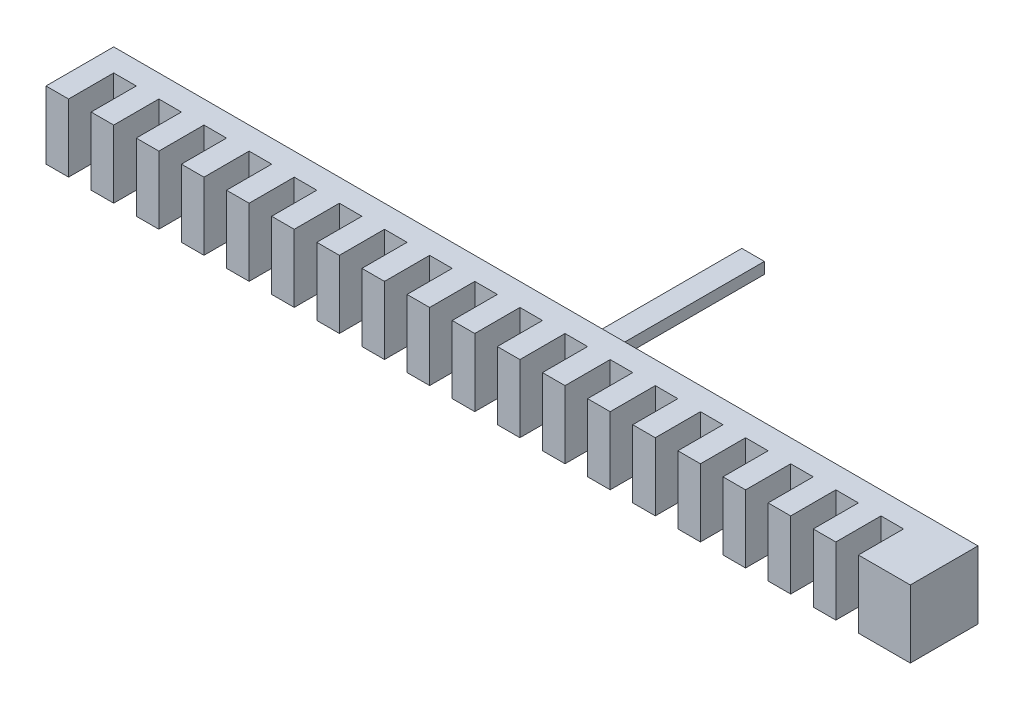
from build123d import *

# Parameters (mm, degrees)
ESQUISSE1_W        = 383
ESQUISSE1_H        = 30
BOSS_EXTRU_1_DEPTH = 10
ESQUISSE2_W        = 10
ESQUISSE2_H        = 30
BOSS_EXTRU_2_DEPTH = 20
ESQUISSE3_W        = 10
ESQUISSE3_H        = 100
BOSS_EXTRU_3_DEPTH = 5


with BuildPart() as part:
    # Esquisse1 → Boss.-Extru.1 (new body)
    with BuildSketch(Plane.XY):
        Rectangle(ESQUISSE1_W, ESQUISSE1_H)
    extrude(amount=BOSS_EXTRU_1_DEPTH)

    # Esquisse2 → Boss.-Extru.2 (add)
    with BuildSketch(Plane.XY.offset(10)):
        with Locations((-186.5, 0)):
            Rectangle(ESQUISSE2_W, ESQUISSE2_H)
        with Locations((-166.5, 0)):
            Rectangle(ESQUISSE2_W, ESQUISSE2_H)
        with Locations((-146.5, 0)):
            Rectangle(ESQUISSE2_W, ESQUISSE2_H)
        with Locations((-126.5, 0)):
            Rectangle(ESQUISSE2_W, ESQUISSE2_H)
        with Locations((-106.5, 0)):
            Rectangle(ESQUISSE2_W, ESQUISSE2_H)
        with Locations((-86.5, 0)):
            Rectangle(ESQUISSE2_W, ESQUISSE2_H)
        with Locations((-66.5, 0)):
            Rectangle(ESQUISSE2_W, ESQUISSE2_H)
        with Locations((-46.5, 0)):
            Rectangle(ESQUISSE2_W, ESQUISSE2_H)
        with Locations((-26.5, 0)):
            Rectangle(ESQUISSE2_W, ESQUISSE2_H)
        with Locations((-6.5, 0)):
            Rectangle(ESQUISSE2_W, ESQUISSE2_H)
        with Locations((13.5, 0)):
            Rectangle(ESQUISSE2_W, ESQUISSE2_H)
        with Locations((33.5, 0)):
            Rectangle(ESQUISSE2_W, ESQUISSE2_H)
        with Locations((53.5, 0)):
            Rectangle(ESQUISSE2_W, ESQUISSE2_H)
        with Locations((73.5, 0)):
            Rectangle(ESQUISSE2_W, ESQUISSE2_H)
        with Locations((93.5, 0)):
            Rectangle(ESQUISSE2_W, ESQUISSE2_H)
        with Locations((113.5, 0)):
            Rectangle(ESQUISSE2_W, ESQUISSE2_H)
        with Locations((133.5, 0)):
            Rectangle(ESQUISSE2_W, ESQUISSE2_H)
        with Locations((153.5, 0)):
            Rectangle(ESQUISSE2_W, ESQUISSE2_H)
        Polygon((168.5, -15), (178.5, -15), (191.5, -15), (191.5, 15), (178.5, 15), (168.5, 15), align=None)
    extrude(amount=BOSS_EXTRU_2_DEPTH)

    # Esquisse3 → Boss.-Extru.3 (add)
    with BuildSketch(Plane.XZ.offset(15)):
        with Locations((0, -41.837008413)):
            Rectangle(ESQUISSE3_W, ESQUISSE3_H)
    extrude(amount=BOSS_EXTRU_3_DEPTH)


solid = part.part
